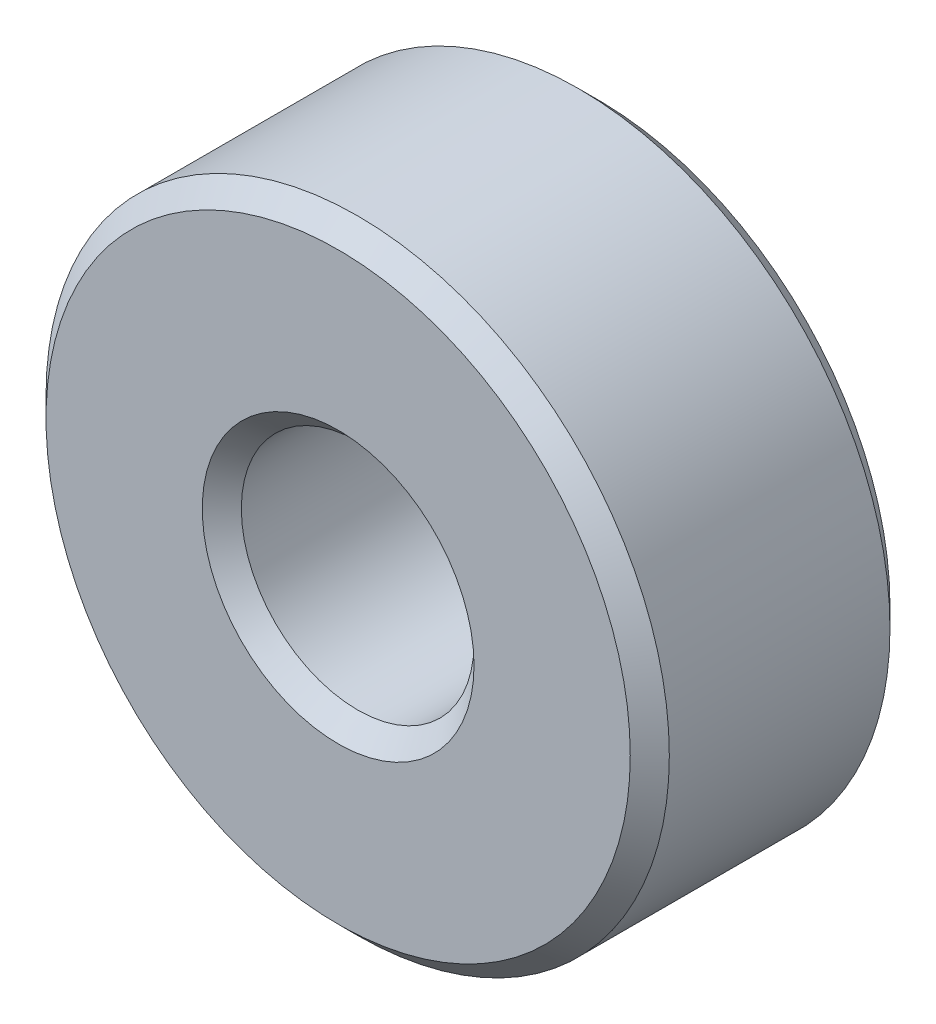
from build123d import *

# Parameters (mm, degrees)
BOSS_EXTRUDE1_DEPTH      = 1.984375
BOSS_EXTRUDE1_DEPTH_BACK = 1.984375
SKETCH3_R                = 4.7625
SKETCH3_R_2              = 1.778
CHAMFER1_SIZE            = 0.29845


with BuildPart() as part:
    # Sketch3 → Boss-Extrude1 (new, two sides: drawn at the far end of the back side and taken through both)
    with BuildSketch(Plane.XY.offset(-BOSS_EXTRUDE1_DEPTH_BACK)):
        Circle(SKETCH3_R)
        Circle(SKETCH3_R_2, mode=Mode.SUBTRACT)
    extrude(amount=BOSS_EXTRUDE1_DEPTH + BOSS_EXTRUDE1_DEPTH_BACK)

    # Chamfer1
    chamfer1_edges = [part.edges().sort_by_distance(p)[0] for p in [
        (-4.7625, 0, -1.984375),
        (-1.778, 0, -1.984375),
        (-4.7625, 0, 1.984375),
        (-1.778, 0, 1.984375),
    ]]
    chamfer(chamfer1_edges, length=CHAMFER1_SIZE)


solid = part.part
